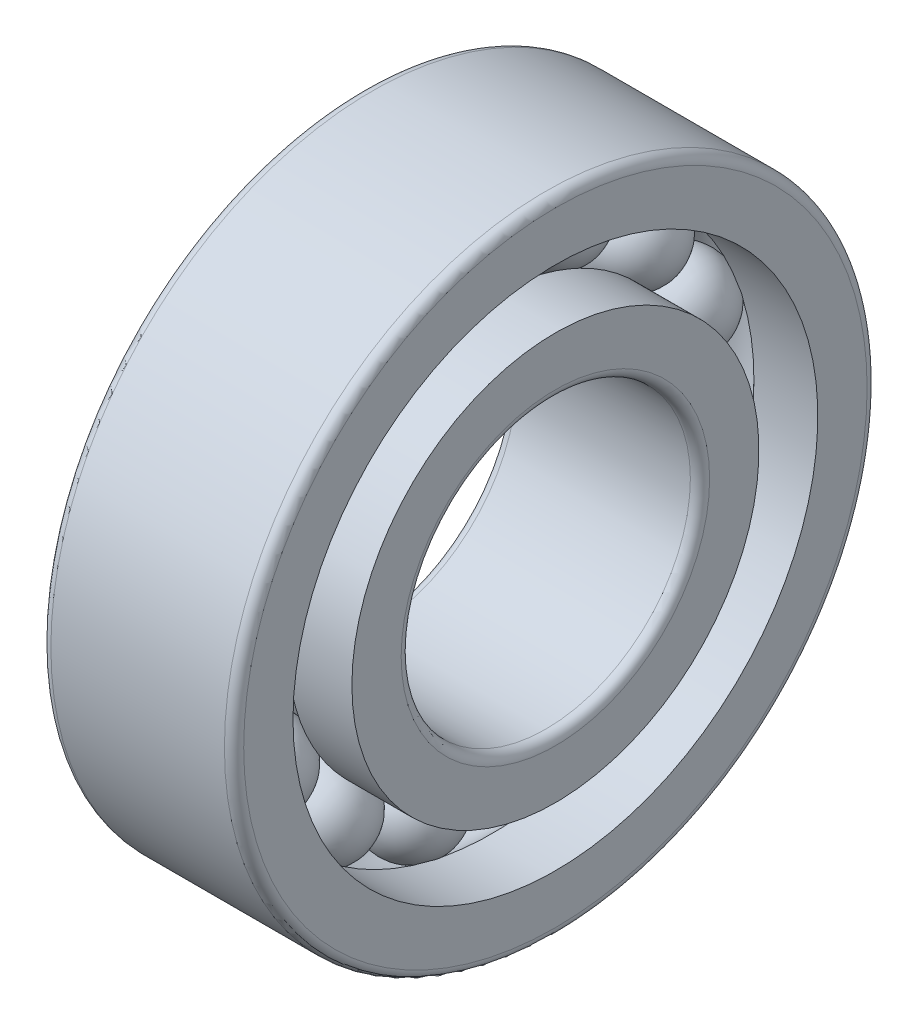
from build123d import *

# Parameters (mm, degrees)
CIRCULAR_PATTERN1_COUNT = 15
FILLET1_R               = 0.3


with BuildPart() as part:
    # Sketch1 → Revolve1 (revolve)
    with BuildSketch(Plane.XY):
        with BuildLine():
            Line((-1.375, 7.25), (1.375, 7.25))
            ThreePointArc((1.375, 7.25), (0, 8.625), (-1.375, 7.25))
        make_face()
    revolve1 = revolve(axis=Axis((-4.596601835, 7.25, 0), (1, 0, 0)))

    # Sketch2 → Revolve2 (revolve)
    with BuildSketch(Plane.XY, mode=Mode.PRIVATE) as revolve2_sk:
        with BuildLine():
            Line((-3, 6.333333333), (-3, 4.5))
            Line((-3, 4.5), (3, 4.5))
            Line((3, 4.5), (3, 6.333333333))
            Line((3, 6.333333333), (1.011408534, 6.333333333))
            ThreePointArc((1.011408534, 6.333333333), (0, 5.885), (-1.011408534, 6.333333333))
            Line((-1.011408534, 6.333333333), (-3, 6.333333333))
        make_face()
    revolve(revolve2_sk.sketch.rotate(Axis((-6.971390126, 0, 0), (1, 0, 0)), 90), axis=Axis((-6.971390126, 0, 0), (1, 0, 0)))

    # Sketch3 → Revolve3 (revolve)
    with BuildSketch(Plane.XY, mode=Mode.PRIVATE) as revolve3_sk:
        with BuildLine():
            Line((-3, 10), (3, 10))
            Line((3, 10), (3, 8.166666667))
            Line((3, 8.166666667), (1.011408534, 8.166666667))
            ThreePointArc((1.011408534, 8.166666667), (0, 8.615), (-1.011408534, 8.166666667))
            Line((-1.011408534, 8.166666667), (-3, 8.166666667))
            Line((-3, 8.166666667), (-3, 10))
        make_face()
    revolve(revolve3_sk.sketch.rotate(Axis((-8.710676495, 0, 0), (1, 0, 0)), 90), axis=Axis((-8.710676495, 0, 0), (1, 0, 0)))

    # Circular-Pattern1: Revolve1 ×15 about axis
    circular_pattern1_axis = Axis((0, 0, 0), (1, 0, 0))
    for i in range(1, CIRCULAR_PATTERN1_COUNT):
        add(revolve1.rotate(circular_pattern1_axis, i * 360 / CIRCULAR_PATTERN1_COUNT))

    # Fillet1
    fillet1_edges = [part.edges().sort_by_distance(p)[0] for p in [
        (-3, 0, -10),
        (3, 0, -10),
        (-3, 0, -4.5),
        (3, 0, -4.5),
    ]]
    fillet(fillet1_edges, radius=FILLET1_R)


solid = part.part
